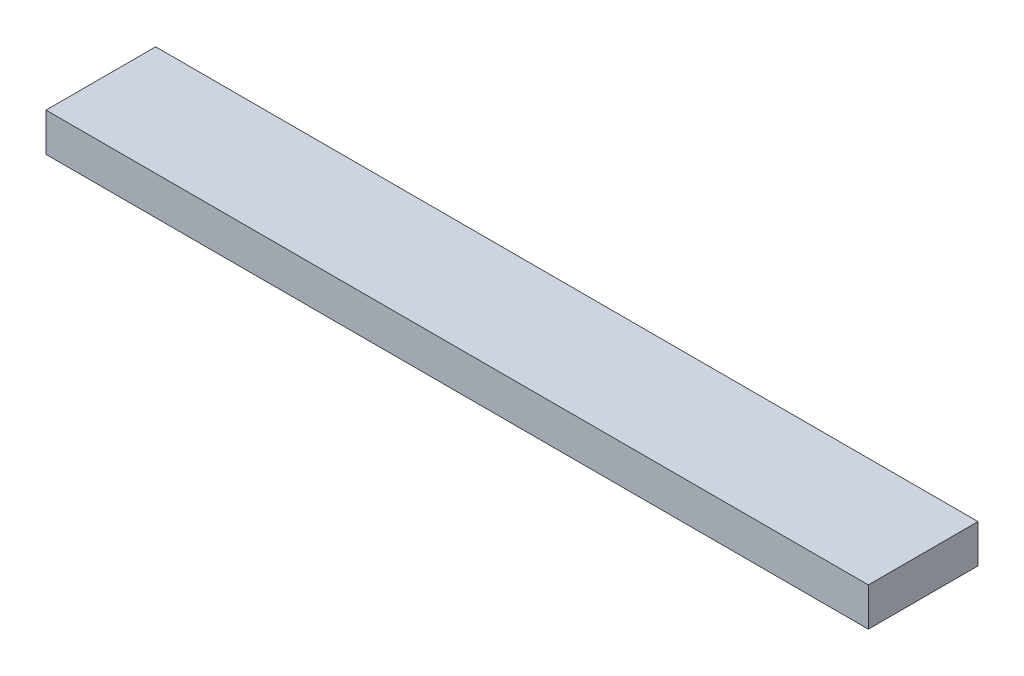
from build123d import *

# Parameters (mm, degrees)
SKETCH1_W           = 150
SKETCH1_H           = 20
BOSS_EXTRUDE1_DEPTH = 7


with BuildPart() as part:
    # Sketch1 → Boss-Extrude1 (new body)
    with BuildSketch(Plane(origin=(0, 0, 0), x_dir=(1, 0, 0), z_dir=(0, 1, 0))):
        with Locations((75, 10)):
            Rectangle(SKETCH1_W, SKETCH1_H)
    extrude(amount=BOSS_EXTRUDE1_DEPTH)


solid = part.part
